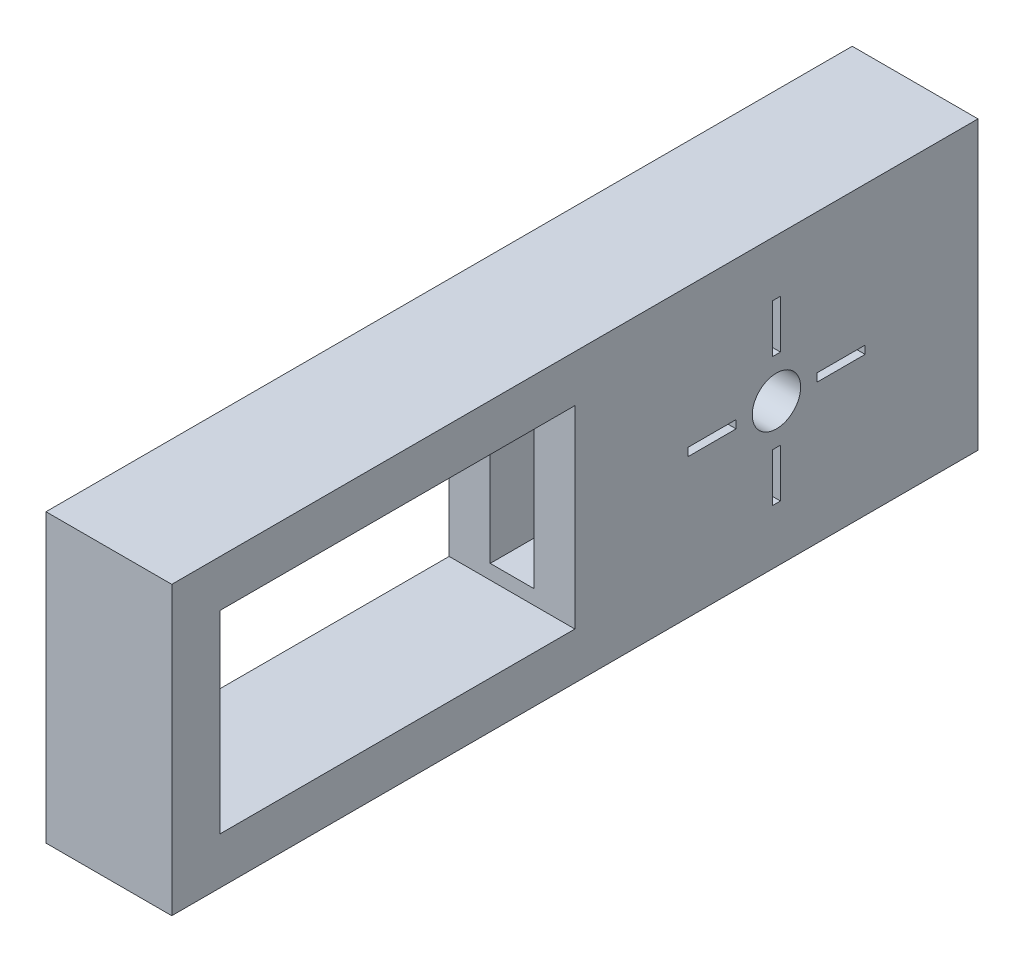
from build123d import *

# Parameters (mm, degrees)
SKETCH1_W           = 17.8
SKETCH1_H           = 25
SKETCH1_R           = 1.5
BOSS_EXTRUDE1_DEPTH = 3.9
SKETCH3_W           = 0.5
SKETCH3_H           = 3
CUT_EXTRUDE1_DEPTH  = 10
CIRPATTERN1_COUNT   = 4
SKETCH4_W           = 2.7
SKETCH4_H           = 10.2
CUT_EXTRUDE2_DEPTH  = 18
SKETCH5_W           = 2.8
SKETCH5_H           = 9
CUT_EXTRUDE3_DEPTH  = 10
SKETCH6_W           = 7.8
SKETCH6_H           = 17.8
BOSS_EXTRUDE2_DEPTH = 25
SKETCH7_W           = 22
SKETCH7_H           = 12
CUT_EXTRUDE4_DEPTH  = 30


with BuildPart() as part:
    # Sketch1 → Boss-Extrude1 (new, symmetric)
    with BuildSketch(Plane.YZ):
        Rectangle(SKETCH1_W, SKETCH1_H)
        with Locations(Location((0, 0, 0), (0, 0, 270))):
            Circle(SKETCH1_R, mode=Mode.SUBTRACT)
    extrude(amount=BOSS_EXTRUDE1_DEPTH, both=True)

    # Sketch3 → Cut-Extrude1 (cut)
    with BuildSketch(Plane(origin=(3.9, 0, 0), x_dir=(0, 0, -1), z_dir=(1, 0, 0))):
        with Locations((0, 4)):
            Rectangle(SKETCH3_W, SKETCH3_H)
    cut_extrude1 = extrude(amount=-CUT_EXTRUDE1_DEPTH, mode=Mode.SUBTRACT)

    # CirPattern1: Cut-Extrude1 ×4 about axis
    cirpattern1_axis = Axis((0, 0, 0), (1, 0, 0))
    for i in range(1, CIRPATTERN1_COUNT):
        add(cut_extrude1.rotate(cirpattern1_axis, i * 360 / CIRPATTERN1_COUNT), mode=Mode.SUBTRACT)

    # Sketch4 → Cut-Extrude2 (cut)
    with BuildSketch(Plane.XY.offset(12.5)):
        Rectangle(SKETCH4_W, SKETCH4_H)
    extrude(amount=-CUT_EXTRUDE2_DEPTH, mode=Mode.SUBTRACT)

    # Sketch5 → Cut-Extrude3 (cut)
    with BuildSketch(Plane(origin=(0, 0, -12.5), x_dir=(-1, 0, 0), z_dir=(0, 0, -1))):
        Rectangle(SKETCH5_W, SKETCH5_H)
    extrude(amount=-CUT_EXTRUDE3_DEPTH, mode=Mode.SUBTRACT)

    # Sketch6 → Boss-Extrude2 (add)
    with BuildSketch(Plane.XY.offset(12.5)):
        Rectangle(SKETCH6_W, SKETCH6_H)
    extrude(amount=BOSS_EXTRUDE2_DEPTH)

    # Sketch7 → Cut-Extrude4 (cut)
    with BuildSketch(Plane(origin=(3.9, 0, 0), x_dir=(0, 0, -1), z_dir=(1, 0, 0))):
        with Locations((-23.5, 0)):
            Rectangle(SKETCH7_W, SKETCH7_H)
    extrude(amount=-CUT_EXTRUDE4_DEPTH, mode=Mode.SUBTRACT)


solid = part.part
